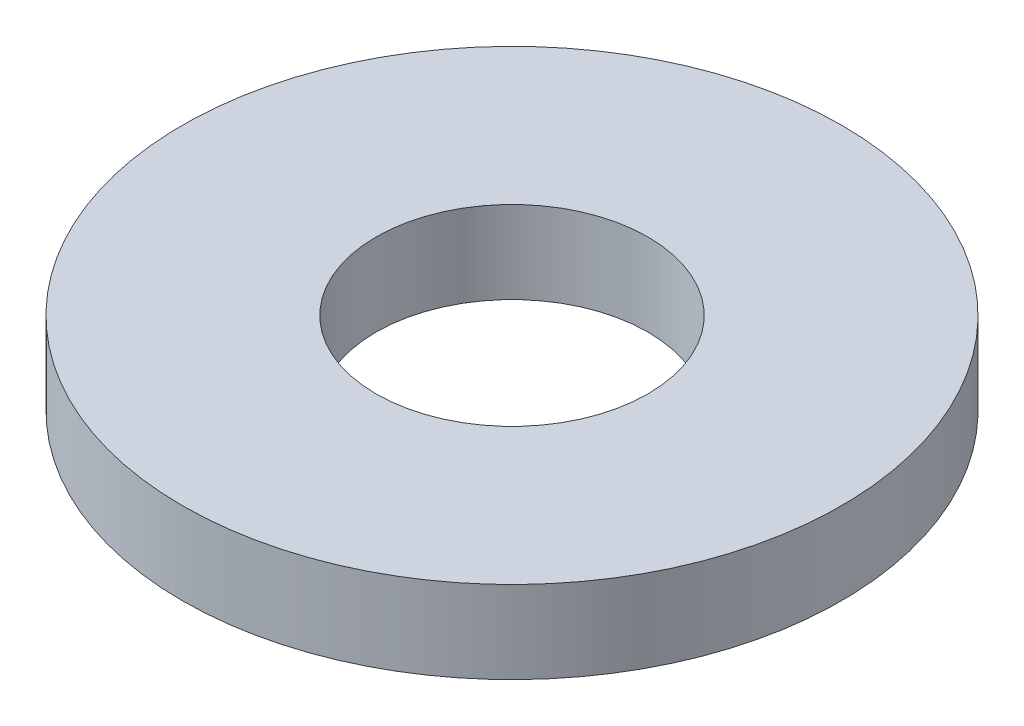
from build123d import *

# Parameters (mm, degrees)
CROQUIS1_R              = 4
SALIENTE_EXTRUIR1_DEPTH = 1
CROQUIS2_R              = 1.65
CORTAR_EXTRUIR1_DEPTH   = 6.744562647


with BuildPart() as part:
    # Croquis1 → Saliente-Extruir1 (new body)
    with BuildSketch(Plane(origin=(0, 0, 0), x_dir=(1, 0, 0), z_dir=(0, 1, 0))):
        with Locations(Location((0, 0, 0), (0, 0, 270))):
            Circle(CROQUIS1_R)
    extrude(amount=SALIENTE_EXTRUIR1_DEPTH)

    # Croquis2 → Cortar-Extruir1 (cut, through all)
    with BuildSketch(Plane(origin=(0, 1, 0), x_dir=(1, 0, 0), z_dir=(0, 1, 0))):
        with Locations(Location((0, 0, 0), (0, 0, 270))):
            Circle(CROQUIS2_R)
    extrude(amount=-CORTAR_EXTRUIR1_DEPTH, mode=Mode.SUBTRACT)


solid = part.part
